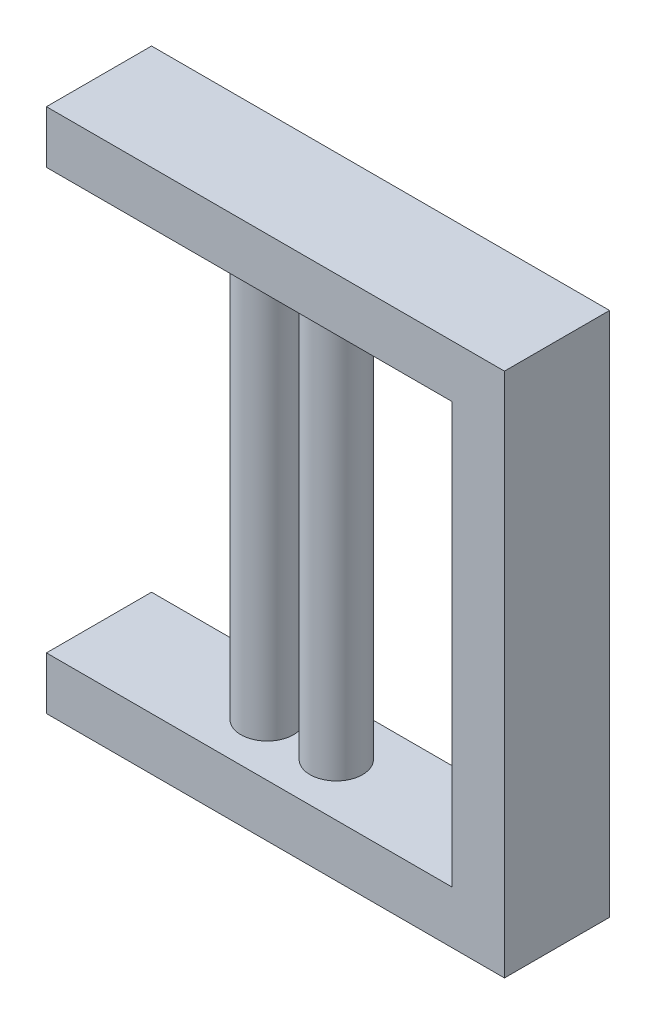
from build123d import *

# Parameters (mm, degrees)
BOSS_EXTRUDE1_DEPTH = 25.4
SKETCH2_R           = 6.35
BOSS_EXTRUDE2_DEPTH = 101.6


with BuildPart() as part:
    # Sketch1 → Boss-Extrude1 (new body)
    with BuildSketch(Plane.XY):
        Polygon((0, 0), (97.980047506, 0), (97.980047506, 101.6), (0, 101.6), (0, 114.3), (110.680047506, 114.3), (110.680047506, -12.7), (0, -12.7), align=None)
    extrude(amount=BOSS_EXTRUDE1_DEPTH)

    # Sketch2 → Boss-Extrude2 (add)
    with BuildSketch(Plane(origin=(0, 0, 0), x_dir=(1, 0, 0), z_dir=(0, 1, 0))):
        with Locations(Location((40.640027753, -12.7, 0), (0, 0, 90))):
            Circle(SKETCH2_R)
        with Locations(Location((57.340019753, -12.7, 0), (0, 0, 90))):
            Circle(SKETCH2_R)
    extrude(amount=BOSS_EXTRUDE2_DEPTH)


solid = part.part
